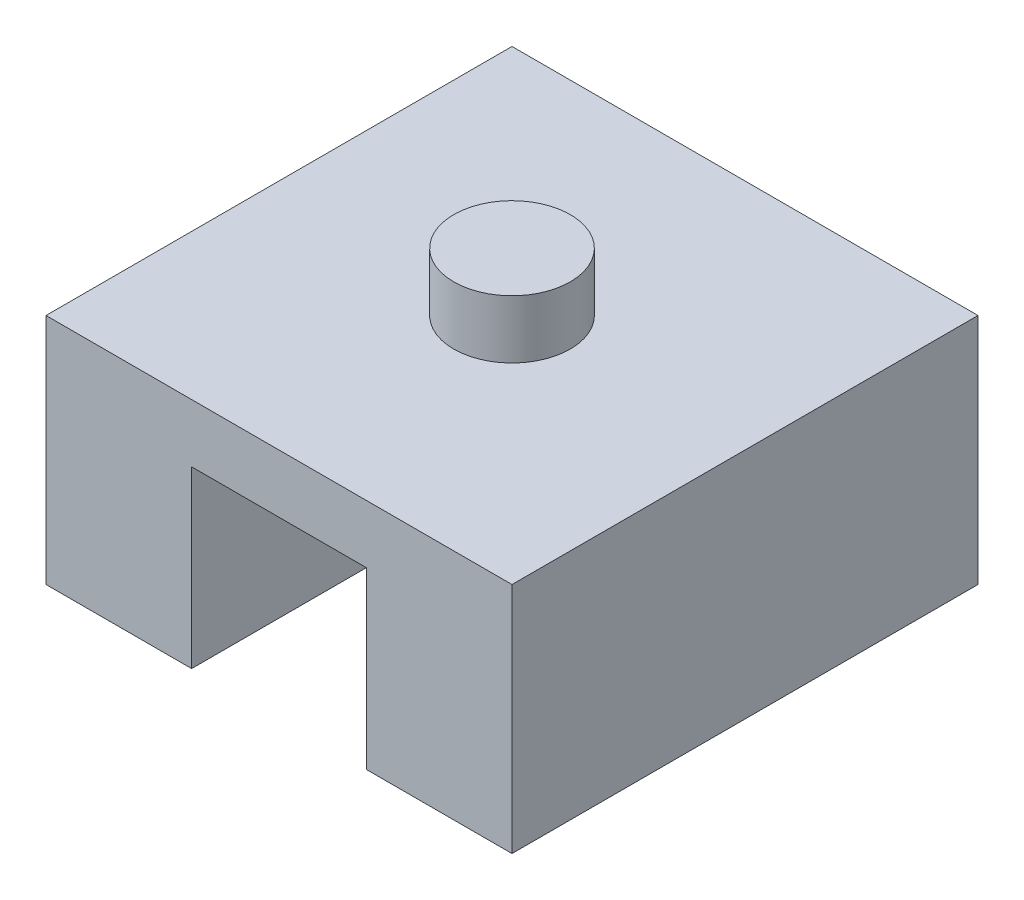
from build123d import *

# Parameters (mm, degrees)
SKETCH1_W           = 50.8
SKETCH1_H           = 25.4
BOSS_EXTRUDE1_DEPTH = 50.8
SKETCH2_W           = 19.05
SKETCH2_H           = 19.05
CUT_EXTRUDE1_DEPTH  = 50.8
SKETCH3_R           = 6.35
BOSS_EXTRUDE2_DEPTH = 6.35


with BuildPart() as part:
    # Sketch1 → Boss-Extrude1 (new body)
    with BuildSketch(Plane.XY):
        with Locations((25.4, 12.7)):
            Rectangle(SKETCH1_W, SKETCH1_H)
    extrude(amount=BOSS_EXTRUDE1_DEPTH)

    # Sketch2 → Cut-Extrude1 (cut)
    with BuildSketch(Plane.XY.offset(50.8)):
        with Locations((25.4, 9.525)):
            Rectangle(SKETCH2_W, SKETCH2_H)
    extrude(amount=-CUT_EXTRUDE1_DEPTH, mode=Mode.SUBTRACT)

    # Sketch3 → Boss-Extrude2 (add)
    with BuildSketch(Plane(origin=(0, 25.4, 0), x_dir=(1, 0, 0), z_dir=(0, 1, 0))):
        with Locations(Location((25.4, -25.4, 0), (0, 0, 270))):
            Circle(SKETCH3_R)
    extrude(amount=BOSS_EXTRUDE2_DEPTH)


solid = part.part
